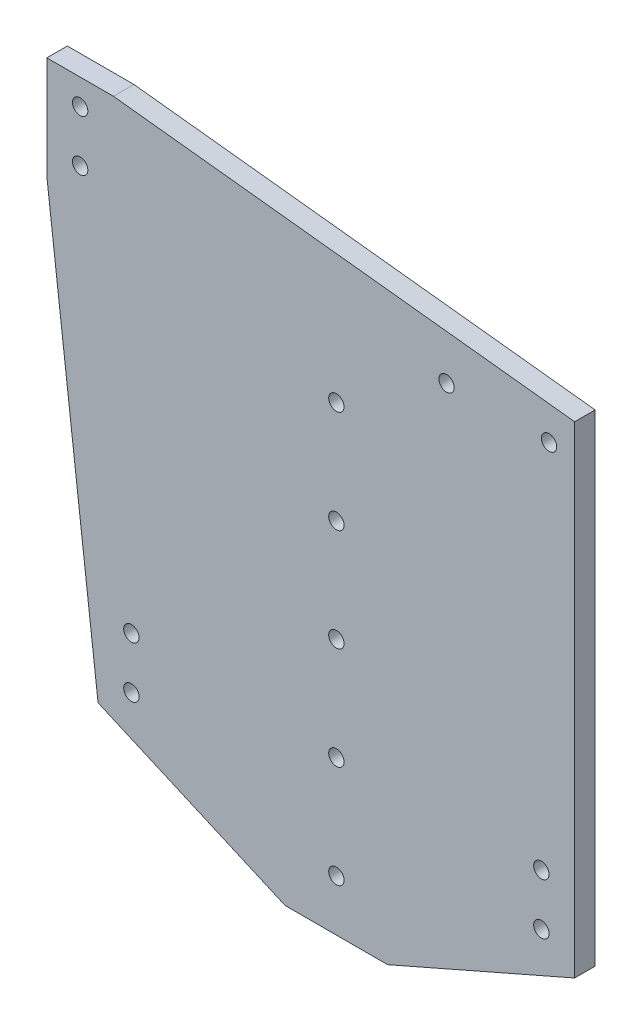
from build123d import *

# Parameters (mm, degrees)
SKETCH_1_R      = 1.5
EXTRUDE_1_DEPTH = 4


with BuildPart() as part:
    # 草图1 → 凸台-拉伸1 (new body)
    with BuildSketch(Plane.XY):
        Polygon((0, 0), (0, 94), (-90, 104), (-103, 104), (-103, 84), (-93, 0), (-56.5, -16), (-36.5, -16), align=None)
        with Locations((-86.5, 15)):
            Circle(SKETCH_1_R, mode=Mode.SUBTRACT)
        with Locations(Location((-86.5, 5, 0), (0, 0, 180))):
            Circle(SKETCH_1_R, mode=Mode.SUBTRACT)
        with Locations((-6.5, 5)):
            Circle(SKETCH_1_R, mode=Mode.SUBTRACT)
        with Locations(Location((-6.5, 15, 0), (0, 0, 180))):
            Circle(SKETCH_1_R, mode=Mode.SUBTRACT)
        with Locations((-96.5, 99)):
            Circle(SKETCH_1_R, mode=Mode.SUBTRACT)
        with Locations((-96.5, 89)):
            Circle(SKETCH_1_R, mode=Mode.SUBTRACT)
        with Locations((-46.5, 14)):
            Circle(SKETCH_1_R, mode=Mode.SUBTRACT)
        with Locations((-46.5, 34)):
            Circle(SKETCH_1_R, mode=Mode.SUBTRACT)
        with Locations((-46.5, 54)):
            Circle(SKETCH_1_R, mode=Mode.SUBTRACT)
        with Locations((-46.5, 74)):
            Circle(SKETCH_1_R, mode=Mode.SUBTRACT)
        with Locations((-46.5, -6)):
            Circle(SKETCH_1_R, mode=Mode.SUBTRACT)
        with Locations((-25, 88)):
            Circle(SKETCH_1_R, mode=Mode.SUBTRACT)
        with Locations((-5, 88)):
            Circle(SKETCH_1_R, mode=Mode.SUBTRACT)
    extrude(amount=EXTRUDE_1_DEPTH)


solid = part.part
